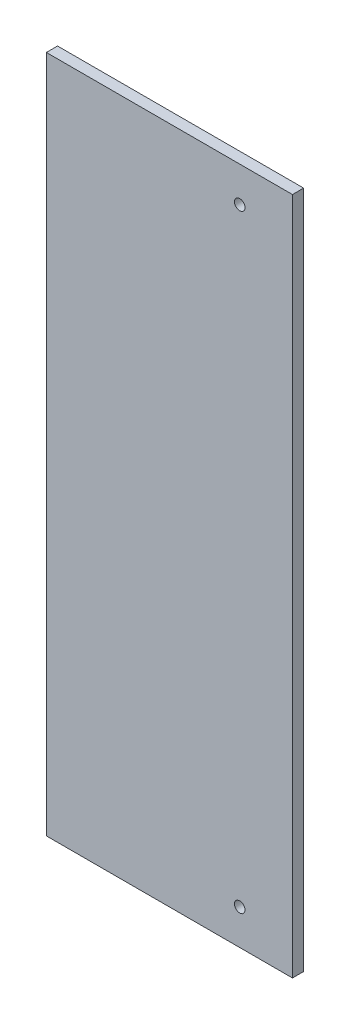
from build123d import *

# Parameters (mm, degrees)
SKETCH1_W           = 70
SKETCH1_H           = 193
SKETCH1_R           = 1.5
BOSS_EXTRUDE1_DEPTH = 3.175


with BuildPart() as part:
    # Sketch1 → Boss-Extrude1 (new body)
    with BuildSketch(Plane.XY):
        with Locations((35, 96.5)):
            Rectangle(SKETCH1_W, SKETCH1_H)
        with Locations((55, 183)):
            Circle(SKETCH1_R, mode=Mode.SUBTRACT)
        with Locations((55, 10)):
            Circle(SKETCH1_R, mode=Mode.SUBTRACT)
    extrude(amount=BOSS_EXTRUDE1_DEPTH)


solid = part.part
